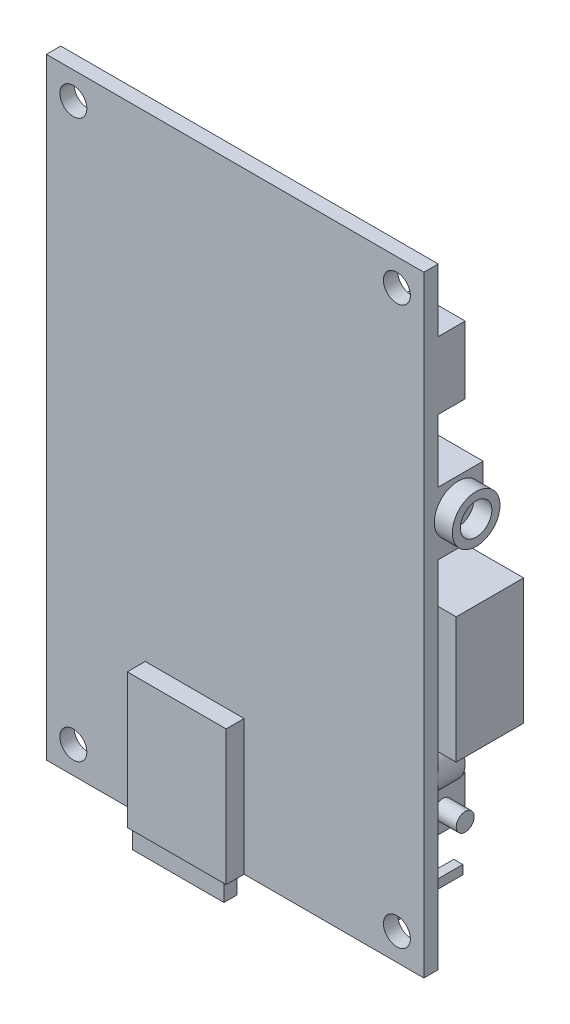
from build123d import *

# Parameters (mm, degrees)
SCHIZZO1_W                    = 42
SCHIZZO1_H                    = 68
ESTRUSIONE_ESTRUSIONE1_DEPTH  = 1.6
TAGLIO_ESTRUSIONE1_REACH      = 41.994
SCHIZZO2_R                    = 1.5
SCHIZZO4_W                    = 6
SCHIZZO4_H                    = 7.5
ESTRUSIONE_ESTRUSIONE2_DEPTH  = 3
SCHIZZO5_W                    = 12
SCHIZZO5_H                    = 7
ESTRUSIONE_ESTRUSIONE3_DEPTH  = 5
SCHIZZO6_R                    = 2.65
SCHIZZO6_R_2                  = 1.75
ESTRUSIONE_ESTRUSIONE4_DEPTH  = 2
SCHIZZO7_W                    = 12
SCHIZZO7_H                    = 14
ESTRUSIONE_ESTRUSIONE5_DEPTH  = 7.5
SCHIZZO8_W                    = 7.5
SCHIZZO8_H                    = 14
ESTRUSIONE_ESTRUSIONE6_DEPTH  = 2
SCHIZZO9_R                    = 2.5
ESTRUSIONE_ESTRUSIONE7_DEPTH  = 3
SCHIZZO11_W                   = 3
SCHIZZO11_H                   = 4.5
ESTRUSIONE_ESTRUSIONE8_DEPTH  = 5
SCHIZZO12_R                   = 1
ESTRUSIONE_ESTRUSIONE9_DEPTH  = 2.5
SCHIZZO13_W                   = 11
SCHIZZO13_H                   = 15
ESTRUSIONE_ESTRUSIONE10_DEPTH = 2
SCHIZZO14_W                   = 10.150600352
SCHIZZO14_H                   = 1.441134618
ESTRUSIONE_ESTRUSIONE11_DEPTH = 2
SCHIZZO15_W                   = 5
SCHIZZO15_H                   = 51
ESTRUSIONE_ESTRUSIONE12_DEPTH = 2
SCHIZZO16_W                   = 1
SCHIZZO16_H                   = 1
ESTRUSIONE_ESTRUSIONE13_DEPTH = 7
SCHIZZO17_W                   = 2
SCHIZZO17_H                   = 7
ESTRUSIONE_ESTRUSIONE14_DEPTH = 2
SCHIZZO18_W                   = 1
SCHIZZO18_H                   = 1
ESTRUSIONE_ESTRUSIONE15_DEPTH = 7
SCHIZZO19_W                   = 7
SCHIZZO19_H                   = 2
ESTRUSIONE_ESTRUSIONE16_DEPTH = 2
SCHIZZO20_W                   = 1
SCHIZZO20_H                   = 1
ESTRUSIONE_ESTRUSIONE17_DEPTH = 7


with BuildPart() as part:
    # Schizzo1 → Estrusione-Estrusione1 (new body)
    with BuildSketch(Plane.XY):
        Rectangle(SCHIZZO1_W, SCHIZZO1_H)
    extrude(amount=ESTRUSIONE_ESTRUSIONE1_DEPTH)

    # Schizzo2 → Taglio-Estrusione1 (cut, up to next)
    with BuildSketch(Plane(origin=(0, 0, 0), x_dir=(-1, 0, 0), z_dir=(0, 0, -1)), mode=Mode.PRIVATE) as taglio_estrusione1_sk1:
        with Locations((-18, 31)):
            Circle(SCHIZZO2_R)
    taglio_estrusione1_tool1 = extrude(taglio_estrusione1_sk1.sketch, amount=-TAGLIO_ESTRUSIONE1_REACH, mode=Mode.PRIVATE) & part.part
    # Schizzo2 → Taglio-Estrusione1 (cut, up to next)
    with BuildSketch(Plane(origin=(0, 0, 0), x_dir=(-1, 0, 0), z_dir=(0, 0, -1)), mode=Mode.PRIVATE) as taglio_estrusione1_sk2:
        with Locations((18, 31)):
            Circle(SCHIZZO2_R)
    taglio_estrusione1_tool2 = extrude(taglio_estrusione1_sk2.sketch, amount=-TAGLIO_ESTRUSIONE1_REACH, mode=Mode.PRIVATE) & part.part
    # Schizzo2 → Taglio-Estrusione1 (cut, up to next)
    with BuildSketch(Plane(origin=(0, 0, 0), x_dir=(-1, 0, 0), z_dir=(0, 0, -1)), mode=Mode.PRIVATE) as taglio_estrusione1_sk3:
        with Locations((18, -31)):
            Circle(SCHIZZO2_R)
    taglio_estrusione1_tool3 = extrude(taglio_estrusione1_sk3.sketch, amount=-TAGLIO_ESTRUSIONE1_REACH, mode=Mode.PRIVATE) & part.part
    # Schizzo2 → Taglio-Estrusione1 (cut, up to next)
    with BuildSketch(Plane(origin=(0, 0, 0), x_dir=(-1, 0, 0), z_dir=(0, 0, -1)), mode=Mode.PRIVATE) as taglio_estrusione1_sk4:
        with Locations((-18, -31)):
            Circle(SCHIZZO2_R)
    taglio_estrusione1_tool4 = extrude(taglio_estrusione1_sk4.sketch, amount=-TAGLIO_ESTRUSIONE1_REACH, mode=Mode.PRIVATE) & part.part
    add(taglio_estrusione1_tool1.solids().sort_by_distance((18, 31, 0))[0], mode=Mode.SUBTRACT)
    add(taglio_estrusione1_tool2.solids().sort_by_distance((-18, 31, 0))[0], mode=Mode.SUBTRACT)
    add(taglio_estrusione1_tool3.solids().sort_by_distance((-18, -31, 0))[0], mode=Mode.SUBTRACT)
    add(taglio_estrusione1_tool4.solids().sort_by_distance((18, -31, 0))[0], mode=Mode.SUBTRACT)

    # Schizzo4 → Estrusione-Estrusione2 (add)
    with BuildSketch(Plane(origin=(0, 0, 0), x_dir=(-1, 0, 0), z_dir=(0, 0, -1))):
        with Locations((-18, 23.25)):
            Rectangle(SCHIZZO4_W, SCHIZZO4_H)
    extrude(amount=ESTRUSIONE_ESTRUSIONE2_DEPTH)

    # Schizzo5 → Estrusione-Estrusione3 (add)
    with BuildSketch(Plane(origin=(0, 0, 0), x_dir=(-1, 0, 0), z_dir=(0, 0, -1))):
        with Locations((-15, 9)):
            Rectangle(SCHIZZO5_W, SCHIZZO5_H)
    extrude(amount=ESTRUSIONE_ESTRUSIONE3_DEPTH)

    # Schizzo6 → Estrusione-Estrusione4 (add)
    with BuildSketch(Plane(origin=(21, 0, 0), x_dir=(0, 0, -1), z_dir=(1, 0, 0))):
        with Locations(Location((2.214557138, 9.319143241, 0), (0, 0, 270))):
            Circle(SCHIZZO6_R)
        with Locations(Location((2.214557138, 9.319143241, 0), (0, 0, 90))):
            Circle(SCHIZZO6_R_2, mode=Mode.SUBTRACT)
    extrude(amount=ESTRUSIONE_ESTRUSIONE4_DEPTH)

    # Schizzo7 → Estrusione-Estrusione5 (add)
    with BuildSketch(Plane(origin=(0, 0, 0), x_dir=(-1, 0, 0), z_dir=(0, 0, -1))):
        with Locations((-15, -6)):
            Rectangle(SCHIZZO7_W, SCHIZZO7_H)
    extrude(amount=ESTRUSIONE_ESTRUSIONE5_DEPTH)

    # Schizzo8 → Estrusione-Estrusione6 (add)
    with BuildSketch(Plane(origin=(21, 0, 0), x_dir=(0, 0, -1), z_dir=(1, 0, 0))):
        with Locations((3.75, -6)):
            Rectangle(SCHIZZO8_W, SCHIZZO8_H)
    extrude(amount=ESTRUSIONE_ESTRUSIONE6_DEPTH)

    # Schizzo9 → Estrusione-Estrusione7 (add)
    with BuildSketch(Plane(origin=(0, 0, 0), x_dir=(-1, 0, 0), z_dir=(0, 0, -1))):
        with Locations(Location((-18.5, -15.7, 0), (0, 0, 180))):
            Circle(SCHIZZO9_R)
    extrude(amount=ESTRUSIONE_ESTRUSIONE7_DEPTH)

    # Schizzo11 → Estrusione-Estrusione8 (add)
    with BuildSketch(Plane(origin=(0, 0, 0), x_dir=(-1, 0, 0), z_dir=(0, 0, -1))):
        with Locations((-17.5, -20.75)):
            Rectangle(SCHIZZO11_W, SCHIZZO11_H)
    extrude(amount=ESTRUSIONE_ESTRUSIONE8_DEPTH)

    # Schizzo12 → Estrusione-Estrusione9 (add)
    with BuildSketch(Plane(origin=(19, 0, 0), x_dir=(0, 0, -1), z_dir=(1, 0, 0))):
        with Locations(Location((2.5, -20.75, 0), (0, 0, 180))):
            Circle(SCHIZZO12_R)
    extrude(amount=ESTRUSIONE_ESTRUSIONE9_DEPTH)

    # Schizzo13 → Estrusione-Estrusione10 (add)
    with BuildSketch(Plane.XY.offset(1.6)):
        with Locations((-4.5, -26.5)):
            Rectangle(SCHIZZO13_W, SCHIZZO13_H)
    extrude(amount=ESTRUSIONE_ESTRUSIONE10_DEPTH)

    # Schizzo14 → Estrusione-Estrusione11 (add)
    with BuildSketch(Plane.XZ.offset(34)):
        with Locations((-4.465208944, 2.729561962)):
            Rectangle(SCHIZZO14_W, SCHIZZO14_H)
    extrude(amount=ESTRUSIONE_ESTRUSIONE11_DEPTH)

    # Schizzo15 → Estrusione-Estrusione12 (add)
    with BuildSketch(Plane(origin=(0, 0, 0), x_dir=(-1, 0, 0), z_dir=(0, 0, -1))):
        with Locations((18.3, 0)):
            Rectangle(SCHIZZO15_W, SCHIZZO15_H)
    extrude(amount=ESTRUSIONE_ESTRUSIONE12_DEPTH)

    # Schizzo16 → Estrusione-Estrusione13 (add)
    with BuildSketch(Plane(origin=(0, 0, -2), x_dir=(-1, 0, 0), z_dir=(0, 0, -1))):
        with Locations((19.702710092, 24.408110806)):
            Rectangle(SCHIZZO16_W, SCHIZZO16_H)
        with Locations((16.702710092, 24.408110806)):
            Rectangle(SCHIZZO16_W, SCHIZZO16_H)
        with Locations((19.702710092, 21.848110806)):
            Rectangle(SCHIZZO16_W, SCHIZZO16_H)
        with Locations((19.702710092, 19.288110806)):
            Rectangle(SCHIZZO16_W, SCHIZZO16_H)
        with Locations((19.702710092, 16.728110806)):
            Rectangle(SCHIZZO16_W, SCHIZZO16_H)
        with Locations((19.702710092, 14.168110806)):
            Rectangle(SCHIZZO16_W, SCHIZZO16_H)
        with Locations((19.702710092, 11.608110806)):
            Rectangle(SCHIZZO16_W, SCHIZZO16_H)
        with Locations((19.702710092, 9.048110806)):
            Rectangle(SCHIZZO16_W, SCHIZZO16_H)
        with Locations((19.702710092, 6.488110806)):
            Rectangle(SCHIZZO16_W, SCHIZZO16_H)
        with Locations((19.702710092, 3.928110806)):
            Rectangle(SCHIZZO16_W, SCHIZZO16_H)
        with Locations((19.702710092, 1.368110806)):
            Rectangle(SCHIZZO16_W, SCHIZZO16_H)
        with Locations((19.702710092, -1.191889194)):
            Rectangle(SCHIZZO16_W, SCHIZZO16_H)
        with Locations((19.702710092, -3.751889194)):
            Rectangle(SCHIZZO16_W, SCHIZZO16_H)
        with Locations((19.702710092, -6.311889194)):
            Rectangle(SCHIZZO16_W, SCHIZZO16_H)
        with Locations((19.702710092, -8.871889194)):
            Rectangle(SCHIZZO16_W, SCHIZZO16_H)
        with Locations((19.702710092, -11.431889194)):
            Rectangle(SCHIZZO16_W, SCHIZZO16_H)
        with Locations((19.702710092, -13.991889194)):
            Rectangle(SCHIZZO16_W, SCHIZZO16_H)
        with Locations((19.702710092, -16.551889194)):
            Rectangle(SCHIZZO16_W, SCHIZZO16_H)
        with Locations((19.702710092, -19.111889194)):
            Rectangle(SCHIZZO16_W, SCHIZZO16_H)
        with Locations((19.702710092, -21.671889194)):
            Rectangle(SCHIZZO16_W, SCHIZZO16_H)
        with Locations((19.702710092, -24.231889194)):
            Rectangle(SCHIZZO16_W, SCHIZZO16_H)
        with Locations((16.702710092, 21.848110806)):
            Rectangle(SCHIZZO16_W, SCHIZZO16_H)
        with Locations((16.702710092, 19.288110806)):
            Rectangle(SCHIZZO16_W, SCHIZZO16_H)
        with Locations((16.702710092, 16.728110806)):
            Rectangle(SCHIZZO16_W, SCHIZZO16_H)
        with Locations((16.702710092, 14.168110806)):
            Rectangle(SCHIZZO16_W, SCHIZZO16_H)
        with Locations((16.702710092, 11.608110806)):
            Rectangle(SCHIZZO16_W, SCHIZZO16_H)
        with Locations((16.702710092, 9.048110806)):
            Rectangle(SCHIZZO16_W, SCHIZZO16_H)
        with Locations((16.702710092, 6.488110806)):
            Rectangle(SCHIZZO16_W, SCHIZZO16_H)
        with Locations((16.702710092, 3.928110806)):
            Rectangle(SCHIZZO16_W, SCHIZZO16_H)
        with Locations((16.702710092, 1.368110806)):
            Rectangle(SCHIZZO16_W, SCHIZZO16_H)
        with Locations((16.702710092, -1.191889194)):
            Rectangle(SCHIZZO16_W, SCHIZZO16_H)
        with Locations((16.702710092, -3.751889194)):
            Rectangle(SCHIZZO16_W, SCHIZZO16_H)
        with Locations((16.702710092, -6.311889194)):
            Rectangle(SCHIZZO16_W, SCHIZZO16_H)
        with Locations((16.702710092, -8.871889194)):
            Rectangle(SCHIZZO16_W, SCHIZZO16_H)
        with Locations((16.702710092, -11.431889194)):
            Rectangle(SCHIZZO16_W, SCHIZZO16_H)
        with Locations((16.702710092, -13.991889194)):
            Rectangle(SCHIZZO16_W, SCHIZZO16_H)
        with Locations((16.702710092, -16.551889194)):
            Rectangle(SCHIZZO16_W, SCHIZZO16_H)
        with Locations((16.702710092, -19.111889194)):
            Rectangle(SCHIZZO16_W, SCHIZZO16_H)
        with Locations((16.702710092, -21.671889194)):
            Rectangle(SCHIZZO16_W, SCHIZZO16_H)
        with Locations((16.702710092, -24.231889194)):
            Rectangle(SCHIZZO16_W, SCHIZZO16_H)
    extrude(amount=ESTRUSIONE_ESTRUSIONE13_DEPTH)

    # Schizzo17 → Estrusione-Estrusione14 (add)
    with BuildSketch(Plane(origin=(0, 0, 0), x_dir=(-1, 0, 0), z_dir=(0, 0, -1))):
        with Locations((-7, -6)):
            Rectangle(SCHIZZO17_W, SCHIZZO17_H)
    extrude(amount=ESTRUSIONE_ESTRUSIONE14_DEPTH)

    # Schizzo18 → Estrusione-Estrusione15 (add)
    with BuildSketch(Plane(origin=(0, 0, -2), x_dir=(-1, 0, 0), z_dir=(0, 0, -1))):
        with Locations((-7, -6)):
            Rectangle(SCHIZZO18_W, SCHIZZO18_H)
        with Locations((-7, -3.338299191)):
            Rectangle(SCHIZZO18_W, SCHIZZO18_H)
        with Locations((-7, -8.661700809)):
            Rectangle(SCHIZZO18_W, SCHIZZO18_H)
    extrude(amount=ESTRUSIONE_ESTRUSIONE15_DEPTH)

    # Schizzo19 → Estrusione-Estrusione16 (add)
    with BuildSketch(Plane(origin=(0, 0, 0), x_dir=(-1, 0, 0), z_dir=(0, 0, -1))):
        with Locations((-11.5, -32)):
            Rectangle(SCHIZZO19_W, SCHIZZO19_H)
    extrude(amount=ESTRUSIONE_ESTRUSIONE16_DEPTH)

    # Schizzo20 → Estrusione-Estrusione17 (add)
    with BuildSketch(Plane(origin=(0, 0, -2), x_dir=(-1, 0, 0), z_dir=(0, 0, -1))):
        with Locations((-11.5, -32)):
            Rectangle(SCHIZZO20_W, SCHIZZO20_H)
        with Locations((-14.226865315, -32)):
            Rectangle(SCHIZZO20_W, SCHIZZO20_H)
        with Locations((-8.773134685, -32)):
            Rectangle(SCHIZZO20_W, SCHIZZO20_H)
    extrude(amount=ESTRUSIONE_ESTRUSIONE17_DEPTH)


solid = part.part
